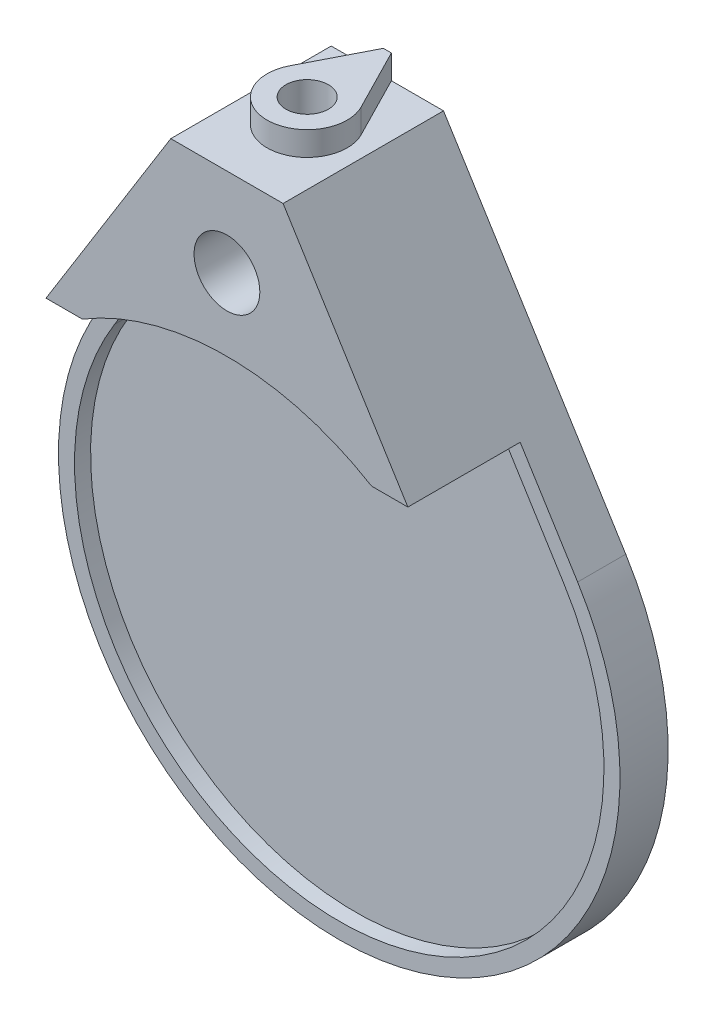
from build123d import *

# Parameters (mm, degrees)
CROQUIS1_R              = 35
SALIENTE_EXTRUIR1_DEPTH = 4
SALIENTE_EXTRUIR2_START = -4
CROQUIS2_R              = 4.1
SALIENTE_EXTRUIR2_DEPTH = 4
CROQUIS4_R              = 4.1
SALIENTE_EXTRUIR5_DEPTH = 16
CROQUIS7_W              = 70
CROQUIS7_H              = 60
CORTAR_EXTRUIR2_DEPTH   = 68.126745787
SALIENTE_EXTRUIR6_DEPTH = 2
CROQUIS12_R             = 2.65
SALIENTE_EXTRUIR8_DEPTH = 3
CORTAR_EXTRUIR5_START   = -16
CROQUIS13_R             = 2.65
CORTAR_EXTRUIR5_DEPTH   = 16


with BuildPart() as part:
    # Croquis1 → Saliente-Extruir1 (new body)
    with BuildSketch(Plane.XY):
        Circle(CROQUIS1_R)
    extrude(amount=SALIENTE_EXTRUIR1_DEPTH)

    # Croquis2 → Saliente-Extruir2 (add)
    with BuildSketch(Plane.XY.offset(4).offset(SALIENTE_EXTRUIR2_START)):
        with BuildLine():
            Line((29.716981132, 18.490566038), (7, 55))
            Line((7, 55), (-7, 55))
            Line((-7, 55), (-29.716981132, 18.490566038))
            ThreePointArc((-29.716981132, 18.490566038), (0, 35), (29.716981132, 18.490566038))
        make_face()
        with Locations((0, 44)):
            Circle(CROQUIS2_R, mode=Mode.SUBTRACT)
    extrude(amount=SALIENTE_EXTRUIR2_DEPTH)

    # Croquis4 → Saliente-Extruir5 (add)
    with BuildSketch(Plane.XY.offset(4)):
        with BuildLine():
            Line((29.716981132, 18.490566038), (7, 55))
            Line((7, 55), (-7, 55))
            Line((-7, 55), (-29.716981132, 18.490566038))
            ThreePointArc((-29.716981132, 18.490566038), (0, 35), (29.716981132, 18.490566038))
        make_face()
        with Locations((0, 44)):
            Circle(CROQUIS4_R, mode=Mode.SUBTRACT)
    extrude(amount=SALIENTE_EXTRUIR5_DEPTH)

    # Croquis7 → Cortar-Extruir2 (cut, through all)
    with BuildSketch(Plane.XY.offset(4)):
        Rectangle(CROQUIS7_W, CROQUIS7_H)
    extrude(amount=CORTAR_EXTRUIR2_DEPTH, mode=Mode.SUBTRACT)

    # Croquis8 → Saliente-Extruir6 (add)
    with BuildSketch(Plane.XY.offset(4)):
        with BuildLine():
            Line((-20.857442348, 28.943396226), (-28.018867925, 17.433962264))
            ThreePointArc((-28.018867925, 17.433962264), (0, -33), (28.018867925, 17.433962264))
            Line((28.018867925, 17.433962264), (20.857442348, 28.943396226))
            Line((20.857442348, 28.943396226), (20.2, 30))
            Line((20.2, 30), (22.555555556, 30))
            Line((22.555555556, 30), (29.716981132, 18.490566038))
            ThreePointArc((29.716981132, 18.490566038), (0, -35), (-29.716981132, 18.490566038))
            Line((-29.716981132, 18.490566038), (-22.555555556, 30))
            Line((-22.555555556, 30), (-20.2, 30))
            Line((-20.2, 30), (-20.857442348, 28.943396226))
        make_face()
    extrude(amount=SALIENTE_EXTRUIR6_DEPTH)

    # Croquis12 → Saliente-Extruir8 (add)
    with BuildSketch(Plane(origin=(0, 55, 0), x_dir=(1, 0, 0), z_dir=(0, 1, 0))):
        with BuildLine():
            Line((-4.451209869, -7.722560493), (-0.5, 0))
            Line((-0.5, 0), (0.5, 0))
            Line((0.5, 0), (4.451209869, -7.722560493))
            ThreePointArc((4.451209869, -7.722560493), (0, -15), (-4.451209869, -7.722560493))
        make_face()
        with Locations(Location((0, -10, 0), (0, 0, 270))):
            Circle(CROQUIS12_R, mode=Mode.SUBTRACT)
    extrude(amount=SALIENTE_EXTRUIR8_DEPTH)

    # Croquis13 → Cortar-Extruir5 (cut)
    with BuildSketch(Plane(origin=(0, 58, 0), x_dir=(1, 0, 0), z_dir=(0, 1, 0)).offset(CORTAR_EXTRUIR5_START)):
        with Locations(Location((0, -10, 0), (0, 0, 270))):
            Circle(CROQUIS13_R)
    extrude(amount=CORTAR_EXTRUIR5_DEPTH, mode=Mode.SUBTRACT)


solid = part.part
